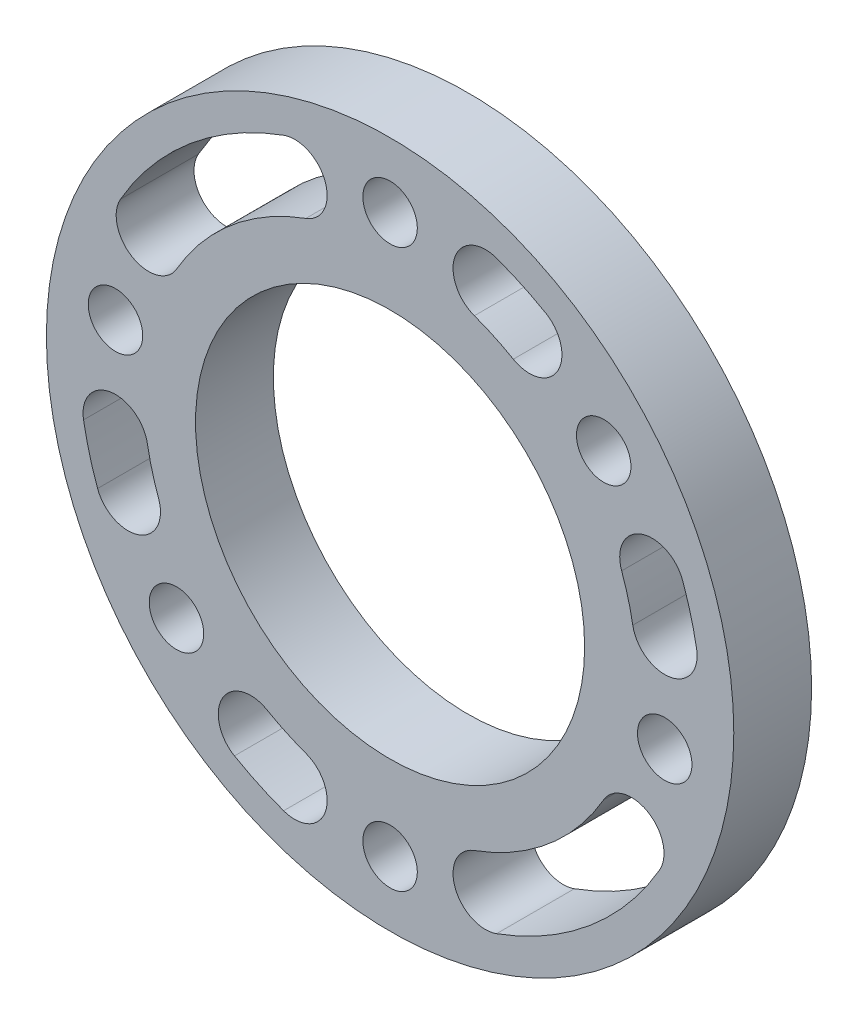
from build123d import *

# Parameters (mm, degrees)
SKETCH_1_R      = 26.5
SKETCH_1_R_2    = 15
SKETCH_1_R_3    = 2.1
EXTRUDE_1_DEPTH = 6


with BuildPart() as part:
    # 草图1 → 凸台-拉伸1 (new body)
    with BuildSketch(Plane.XY):
        Circle(SKETCH_1_R)
        Circle(SKETCH_1_R_2, mode=Mode.SUBTRACT)
        with Locations((0, 21.5)):
            Circle(SKETCH_1_R_3, mode=Mode.SUBTRACT)
        with Locations((16.469955527, 13.819933608)):
            Circle(SKETCH_1_R_3, mode=Mode.SUBTRACT)
        with Locations((21.17336669, -3.73343582)):
            Circle(SKETCH_1_R_3, mode=Mode.SUBTRACT)
        with Locations((0, -21.5)):
            Circle(SKETCH_1_R_3, mode=Mode.SUBTRACT)
        with Locations((-16.469955527, -13.819933608)):
            Circle(SKETCH_1_R_3, mode=Mode.SUBTRACT)
        with Locations((-21.17336669, 3.73343582)):
            Circle(SKETCH_1_R_3, mode=Mode.SUBTRACT)
        with BuildLine():
            ThreePointArc((-8.20848344, 22.552622899), (-15.426902632, 18.385066635), (-20.784609691, 12))
            ThreePointArc((-20.784609691, 12), (-19.869546181, 8.584936491), (-16.454482672, 9.5))
            ThreePointArc((-16.454482672, 9.5), (-12.212964584, 14.554844419), (-6.498382723, 17.854159795))
            ThreePointArc((-6.498382723, 17.854159795), (-5.00420153, 21.058441705), (-8.20848344, 22.552622899))
        make_face(mode=Mode.SUBTRACT)
        with BuildLine():
            ThreePointArc((12, 20.784609691), (10.142838282, 21.751386889), (8.20848344, 22.552622899))
            ThreePointArc((8.20848344, 22.552622899), (5.00420153, 21.058441705), (6.498382723, 17.854159795))
            ThreePointArc((6.498382723, 17.854159795), (8.029746973, 17.219847954), (9.5, 16.454482672))
            ThreePointArc((9.5, 16.454482672), (12.915063509, 17.369546181), (12, 20.784609691))
        make_face(mode=Mode.SUBTRACT)
        with BuildLine():
            ThreePointArc((18.711347307, 3.299315376), (18.352590699, 4.917561857), (17.854159795, 6.498382723))
            ThreePointArc((17.854159795, 6.498382723), (19.348340989, 9.702664633), (22.552622899, 8.20848344))
            ThreePointArc((22.552622899, 8.20848344), (23.182219831, 6.211657082), (23.635386072, 4.167556264))
            ThreePointArc((23.635386072, 4.167556264), (21.607487134, 1.271416437), (18.711347307, 3.299315376))
        make_face(mode=Mode.SUBTRACT)
        with BuildLine():
            ThreePointArc((6.498382723, -17.854159795), (12.212964584, -14.554844419), (16.454482672, -9.5))
            ThreePointArc((16.454482672, -9.5), (19.869546181, -8.584936491), (20.784609691, -12))
            ThreePointArc((20.784609691, -12), (15.426902632, -18.385066635), (8.20848344, -22.552622899))
            ThreePointArc((8.20848344, -22.552622899), (5.00420153, -21.058441705), (6.498382723, -17.854159795))
        make_face(mode=Mode.SUBTRACT)
        with BuildLine():
            ThreePointArc((-9.5, -16.454482672), (-8.029746973, -17.219847954), (-6.498382723, -17.854159795))
            ThreePointArc((-6.498382723, -17.854159795), (-5.00420153, -21.058441705), (-8.20848344, -22.552622899))
            ThreePointArc((-8.20848344, -22.552622899), (-10.142838282, -21.751386889), (-12, -20.784609691))
            ThreePointArc((-12, -20.784609691), (-12.915063509, -17.369546181), (-9.5, -16.454482672))
        make_face(mode=Mode.SUBTRACT)
        with BuildLine():
            ThreePointArc((-23.635386072, -4.167556264), (-23.182219831, -6.211657082), (-22.552622899, -8.20848344))
            ThreePointArc((-22.552622899, -8.20848344), (-19.348340989, -9.702664633), (-17.854159795, -6.498382723))
            ThreePointArc((-17.854159795, -6.498382723), (-18.352590699, -4.917561857), (-18.711347307, -3.299315376))
            ThreePointArc((-18.711347307, -3.299315376), (-21.607487134, -1.271416437), (-23.635386072, -4.167556264))
        make_face(mode=Mode.SUBTRACT)
    extrude(amount=EXTRUDE_1_DEPTH)


solid = part.part
